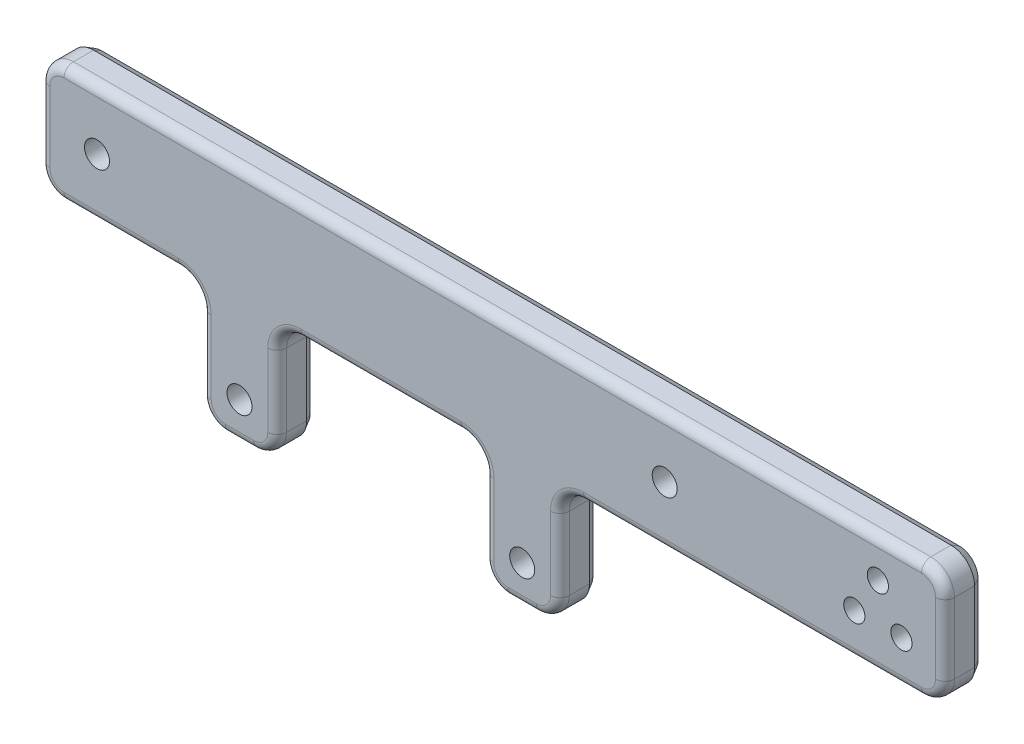
from build123d import *
from OCP.BRepFilletAPI import BRepFilletAPI_MakeChamfer

# Parameters (mm, degrees)
SKETCH2_W           = 192
SKETCH2_H           = 25
BOSS_EXTRUDE1_DEPTH = 8
SKETCH3_R           = 2.65
SKETCH3_R_2         = 2.25
CUT_EXTRUDE1_DEPTH  = 98.140362363
SKETCH5_W           = 16
SKETCH5_H           = 25.5
SKETCH5_R           = 2.65
BOSS_EXTRUDE2_DEPTH = 8
FILLET1_R           = 5
FILLET2_R           = 2
CHAMFER1_SIZE       = 1
CHAMFER1_SIZE2      = 1.732050808
CHAMFER2_SIZE       = 1
CHAMFER2_SIZE2      = 0.577350269


with BuildPart() as part:
    # Sketch2 → Boss-Extrude1 (new body)
    with BuildSketch(Plane.XY):
        Rectangle(SKETCH2_W, SKETCH2_H)
    extrude(amount=BOSS_EXTRUDE1_DEPTH)

    # Sketch3 → Cut-Extrude1 (cut, through all)
    with BuildSketch(Plane.XY.offset(8)):
        with Locations((-84, 0)):
            Circle(SKETCH3_R)
        with Locations((36.5, 0)):
            Circle(SKETCH3_R)
        with Locations((76.75, -3.5)):
            Circle(SKETCH3_R_2)
        with Locations((86.75, -3.5)):
            Circle(SKETCH3_R_2)
        with Locations((81.75, 4.5)):
            Circle(SKETCH3_R_2)
    extrude(amount=-CUT_EXTRUDE1_DEPTH, mode=Mode.SUBTRACT)

    # Sketch5 → Boss-Extrude2 (add)
    # profile 1 of 2: a face of its own
    with BuildSketch(Plane.XY.offset(8)):
        with Locations((-53.75, -25.25)):
            Rectangle(SKETCH5_W, SKETCH5_H)
        with Locations((-53.75, -30)):
            Circle(SKETCH5_R, mode=Mode.SUBTRACT)
    # profile 2 of 2: a face of its own
    with BuildSketch(Plane.XY.offset(8)):
        with Locations((6.25, -25.25)):
            Rectangle(SKETCH5_W, SKETCH5_H)
        with Locations(Location((6.25, -30, 0), (0, 0, 180))):
            Circle(SKETCH5_R, mode=Mode.SUBTRACT)
    extrude(amount=-BOSS_EXTRUDE2_DEPTH)

    # Fillet1
    fillet1_edges = [part.edges().sort_by_distance(p)[0] for p in [
        (-61.75, -38, 4),
        (-61.75, -12.5, 4),
        (-45.75, -12.5, 4),
        (-45.75, -38, 4),
        (14.25, -12.5, 4),
        (14.25, -38, 4),
        (-1.75, -38, 4),
        (-1.75, -12.5, 4),
        (96, -12.5, 4),
        (-96, -12.5, 4),
        (-96, 12.5, 4),
        (96, 12.5, 4),
    ]]
    fillet(fillet1_edges, radius=FILLET1_R)

    # Fillet2
    fillet2_edges = [part.edges().sort_by_distance(p)[0] for p in [
        (15.714466094, -13.964466094, 8),
        (-3.214466094, -13.964466094, 8),
        (-63.214466094, -13.964466094, 8),
        (-44.285533906, -13.964466094, 8),
        (14.25, -25.25, 8),
        (55.125, -12.5, 8),
        (6.25, -38, 8),
        (96, 0, 8),
        (0, 12.5, 8),
        (-96, 0, 8),
        (-78.875, -12.5, 8),
        (-61.75, -25.25, 8),
        (-53.75, -38, 8),
        (-45.75, -25.25, 8),
        (-23.75, -12.5, 8),
        (-1.75, -25.25, 8),
        (94.535533906, 11.035533906, 8),
        (94.535533906, -11.035533906, 8),
        (-94.535533906, 11.035533906, 8),
        (-94.535533906, -11.035533906, 8),
        (-47.214466094, -36.535533906, 8),
        (-60.285533906, -36.535533906, 8),
        (-0.285533906, -36.535533906, 8),
        (12.785533906, -36.535533906, 8),
    ]]
    fillet(fillet2_edges, radius=FILLET2_R)

    # Chamfer1
    chamfer1_edges = [part.edges().sort_by_distance(p)[0] for p in [
        (15.714466094, -13.964466094, 0),
        (-3.214466094, -13.964466094, 0),
        (-63.214466094, -13.964466094, 0),
        (-44.285533906, -13.964466094, 0),
        (14.25, -25.25, 0),
        (55.125, -12.5, 0),
        (6.25, -38, 0),
        (96, 0, 0),
        (-1.75, -25.25, 0),
        (-23.75, -12.5, 0),
        (-45.75, -25.25, 0),
        (-53.75, -38, 0),
        (-61.75, -25.25, 0),
        (-78.875, -12.5, 0),
        (-96, 0, 0),
        (0, 12.5, 0),
        (94.535533906, 11.035533906, 0),
        (94.535533906, -11.035533906, 0),
        (-94.535533906, 11.035533906, 0),
        (-94.535533906, -11.035533906, 0),
        (-47.214466094, -36.535533906, 0),
        (-60.285533906, -36.535533906, 0),
        (-0.285533906, -36.535533906, 0),
        (12.785533906, -36.535533906, 0),
    ]]
    chamfer1_side = [part.faces().sort_by_distance(p)[0] for p in [
        (-3.880983741, -3.433352853, 0),
    ]]
    chamfer(chamfer1_edges, length=CHAMFER1_SIZE, length2=CHAMFER1_SIZE2, reference=chamfer1_side[0])

    # Chamfer2: one chamfer whose edges measure the first distance from different faces: ONE call of the kernel's chamfer builder (chamfer() names one face for all edges)
    chamfer2_edges_1 = [part.edges().sort_by_distance(p)[0] for p in [
        (-86.65, 0, 0),
    ]]
    chamfer2_side_1 = [part.faces().sort_by_distance(p)[0] for p in [
        (-86.65, 0, 4),
    ]]
    chamfer2_edges_2 = [part.edges().sort_by_distance(p)[0] for p in [
        (33.85, 0, 0),
    ]]
    chamfer2_side_2 = [part.faces().sort_by_distance(p)[0] for p in [
        (33.85, 0, 4),
    ]]
    chamfer2_edges_3 = [part.edges().sort_by_distance(p)[0] for p in [
        (74.5, -3.5, 0),
    ]]
    chamfer2_side_3 = [part.faces().sort_by_distance(p)[0] for p in [
        (74.5, -3.5, 4),
    ]]
    chamfer2_edges_4 = [part.edges().sort_by_distance(p)[0] for p in [
        (84.5, -3.5, 0),
    ]]
    chamfer2_side_4 = [part.faces().sort_by_distance(p)[0] for p in [
        (84.5, -3.5, 4),
    ]]
    chamfer2_edges_5 = [part.edges().sort_by_distance(p)[0] for p in [
        (79.5, 4.5, 0),
    ]]
    chamfer2_side_5 = [part.faces().sort_by_distance(p)[0] for p in [
        (79.5, 4.5, 4),
    ]]
    chamfer2_edges_6 = [part.edges().sort_by_distance(p)[0] for p in [
        (-56.4, -30, 0),
    ]]
    chamfer2_side_6 = [part.faces().sort_by_distance(p)[0] for p in [
        (-56.4, -30, 4),
    ]]
    chamfer2_edges_7 = [part.edges().sort_by_distance(p)[0] for p in [
        (8.9, -30, 0),
    ]]
    chamfer2_side_7 = [part.faces().sort_by_distance(p)[0] for p in [
        (8.9, -30, 4),
    ]]
    chamfer2 = BRepFilletAPI_MakeChamfer(part.part.solid().wrapped)
    for e in chamfer2_edges_1:
        chamfer2.Add(CHAMFER2_SIZE, CHAMFER2_SIZE2, e.wrapped, chamfer2_side_1[0].wrapped)  # the first distance lies on this face
    for e in chamfer2_edges_2:
        chamfer2.Add(CHAMFER2_SIZE, CHAMFER2_SIZE2, e.wrapped, chamfer2_side_2[0].wrapped)  # the first distance lies on this face
    for e in chamfer2_edges_3:
        chamfer2.Add(CHAMFER2_SIZE, CHAMFER2_SIZE2, e.wrapped, chamfer2_side_3[0].wrapped)  # the first distance lies on this face
    for e in chamfer2_edges_4:
        chamfer2.Add(CHAMFER2_SIZE, CHAMFER2_SIZE2, e.wrapped, chamfer2_side_4[0].wrapped)  # the first distance lies on this face
    for e in chamfer2_edges_5:
        chamfer2.Add(CHAMFER2_SIZE, CHAMFER2_SIZE2, e.wrapped, chamfer2_side_5[0].wrapped)  # the first distance lies on this face
    for e in chamfer2_edges_6:
        chamfer2.Add(CHAMFER2_SIZE, CHAMFER2_SIZE2, e.wrapped, chamfer2_side_6[0].wrapped)  # the first distance lies on this face
    for e in chamfer2_edges_7:
        chamfer2.Add(CHAMFER2_SIZE, CHAMFER2_SIZE2, e.wrapped, chamfer2_side_7[0].wrapped)  # the first distance lies on this face
    add(Compound.cast(chamfer2.Shape()), mode=Mode.REPLACE)


solid = part.part
